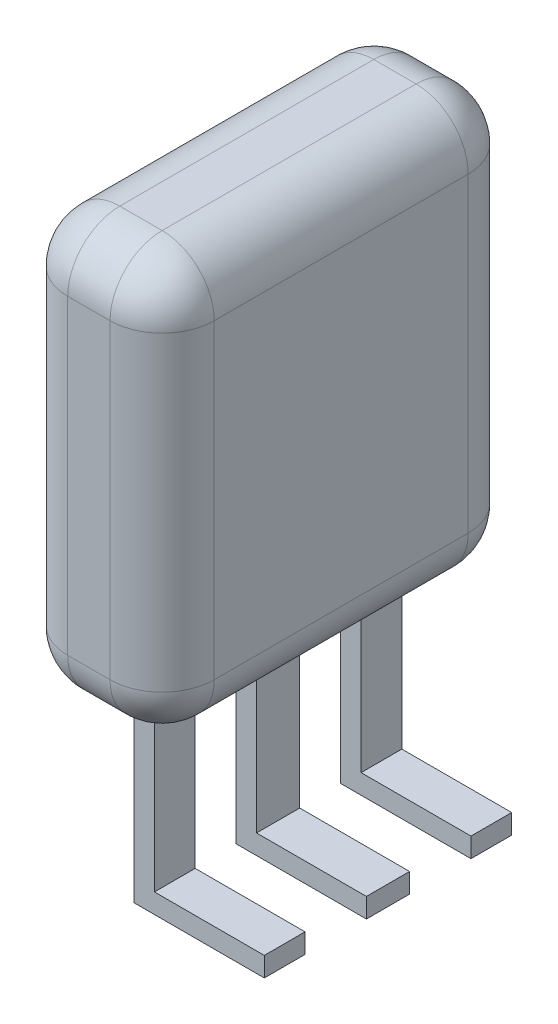
from build123d import *

# Parameters (mm, degrees)
BOSS_EXTRUDE1_DEPTH        = 1.8
FILLET1_R                  = 0.64
BOSS_EXTRUDE2_DEPTH        = 0.125
BOSS_EXTRUDE2_DEPTH_BACK   = 0.125
BOSS_EXTRUDE2_2_DEPTH      = 0.125
BOSS_EXTRUDE2_2_DEPTH_BACK = 0.125
SKETCH2_R                  = 0.15814457
BOSS_EXTRUDE2_3_DEPTH      = 0.125
BOSS_EXTRUDE2_3_DEPTH_BACK = 0.125
SKETCH2_R_2                = 0.159684068
SKETCH4_W                  = 0.500795775
SKETCH4_H                  = 0.240858333
SKETCH4_W_2                = 0.530680686
BOSS_EXTRUDE3_DEPTH        = 1.6


with BuildPart() as part:
    # Sketch1 → Boss-Extrude1 (new body)
    with BuildSketch(Plane(origin=(0, 0, 0), x_dir=(0, 0, -1), z_dir=(1, 0, 0))):
        with BuildLine():
            Line((-1.56, 2.55), (1.56, 2.55))
            ThreePointArc((1.56, 2.55), (2.01254834, 2.36254834), (2.2, 1.91))
            Line((2.2, 1.91), (2.2, -1.91))
            ThreePointArc((2.2, -1.91), (2.01254834, -2.36254834), (1.56, -2.55))
            Line((1.56, -2.55), (-1.56, -2.55))
            ThreePointArc((-1.56, -2.55), (-2.01254834, -2.36254834), (-2.2, -1.91))
            Line((-2.2, -1.91), (-2.2, 1.91))
            ThreePointArc((-2.2, 1.91), (-2.01254834, 2.36254834), (-1.56, 2.55))
        make_face()
    extrude(amount=BOSS_EXTRUDE1_DEPTH)

    # Fillet1
    fillet1_edges = [part.edges().sort_by_distance(p)[0] for p in [
        (1.8, -2.36254834, -2.01254834),
        (0, -2.55, 0),
        (0, -2.36254834, 2.01254834),
        (1.8, 0, -2.2),
        (1.8, 2.36254834, -2.01254834),
        (1.8, 2.55, 0),
        (1.8, 2.36254834, 2.01254834),
        (1.8, 0, 2.2),
        (1.8, -2.36254834, 2.01254834),
        (1.8, -2.55, 0),
        (0, 0, 2.2),
        (0, 2.36254834, 2.01254834),
        (0, 2.55, 0),
        (0, 2.36254834, -2.01254834),
        (0, 0, -2.2),
        (0, -2.36254834, -2.01254834),
    ]]
    fillet(fillet1_edges, radius=FILLET1_R)


with BuildPart() as body_2:
    # Sketch2 → Boss-Extrude2 (new, two sides: drawn at the far end of the back side and taken through both)
    with BuildSketch(Plane(origin=(0.9, 0, 0), x_dir=(0, 0, -1), z_dir=(1, 0, 0)).offset(-BOSS_EXTRUDE2_DEPTH_BACK)):
        Polygon((0.234638485, -1.692845196), (0.234638485, -1.089961788), (0.682917026, -1.089961788), (0.682917026, -0.478873961), (-0.682917026, -0.478873961), (-0.682917026, -1.089961788), (-0.234638485, -1.089961788), (-0.234638485, -1.692845196), (-0.71721526, -1.692845196), (-0.71721526, -2.117211743), (-0.265340343, -2.117211743), (-0.265340343, -4.575084305), (0.265340343, -4.575084305), (0.265340343, -2.117211743), (0.71721526, -2.117211743), (0.71721526, -1.692845196), align=None)
    extrude(amount=BOSS_EXTRUDE2_DEPTH + BOSS_EXTRUDE2_DEPTH_BACK)



with BuildPart() as body_3:
    # Sketch2 → Boss-Extrude2 2 (new, two sides: drawn at the far end of the back side and taken through both)
    with BuildSketch(Plane(origin=(0.9, 0, 0), x_dir=(0, 0, -1), z_dir=(1, 0, 0)).offset(-BOSS_EXTRUDE2_2_DEPTH_BACK)):
        Polygon((-1.519901832, -1.501575177), (-1.519901832, -4.575084305), (-1.019106057, -4.575084305), (-1.019106057, -2.263381464), (-1.019106057, -0.09185167), (0.71721526, -0.09185167), (0.71721526, 0.702562506), (-0.121681947, 0.702562506), (-0.121681947, 1.272911146), (-1.019106057, 1.272911146), (-1.019106057, 2.281206061), (-1.519901832, 2.281206061), align=None)
        with Locations((-1.269503945, -1.91)):
            Circle(SKETCH2_R, mode=Mode.SUBTRACT)
    extrude(amount=BOSS_EXTRUDE2_2_DEPTH + BOSS_EXTRUDE2_2_DEPTH_BACK)


with BuildPart() as body_4:
    # Sketch2 → Boss-Extrude2 3 (new, two sides: drawn at the far end of the back side and taken through both)
    with BuildSketch(Plane(origin=(0.9, 0, 0), x_dir=(0, 0, -1), z_dir=(1, 0, 0)).offset(-BOSS_EXTRUDE2_3_DEPTH_BACK)):
        Polygon((1.019106057, -2.263381464), (1.019106057, -4.575084305), (1.519901832, -4.575084305), (1.519901832, -1.501575177), (1.519901832, 1.91), (1.519901832, 2.281206061), (-0.814248152, 2.281206061), (-0.814248152, 1.761781408), (0.357003518, 1.761781408), (0.357003518, 1.109954392), (1.019106057, 1.109954392), align=None)
        with Locations((1.263450462, -1.91)):
            Circle(SKETCH2_R_2, mode=Mode.SUBTRACT)
    extrude(amount=BOSS_EXTRUDE2_3_DEPTH + BOSS_EXTRUDE2_3_DEPTH_BACK)


with BuildPart() as body_2_1:
    add(body_2.part)

    add(body_3.part)  # Boss-Extrude3 merges body 3

    add(body_4.part)  # Boss-Extrude3 merges body 4
    # Sketch4 → Boss-Extrude3 (add)
    with BuildSketch(Plane(origin=(0.775, 0, 0), x_dir=(0, 0, -1), z_dir=(1, 0, 0))):
        with Locations((-1.269503945, -4.695513471)):
            Rectangle(SKETCH4_W, SKETCH4_H)
        with Locations((0, -4.695513471)):
            Rectangle(SKETCH4_W_2, SKETCH4_H)
        with Locations((1.269503945, -4.695513471)):
            Rectangle(SKETCH4_W, SKETCH4_H)
    extrude(amount=BOSS_EXTRUDE3_DEPTH)


solid = Compound([part.part, body_2_1.part])
